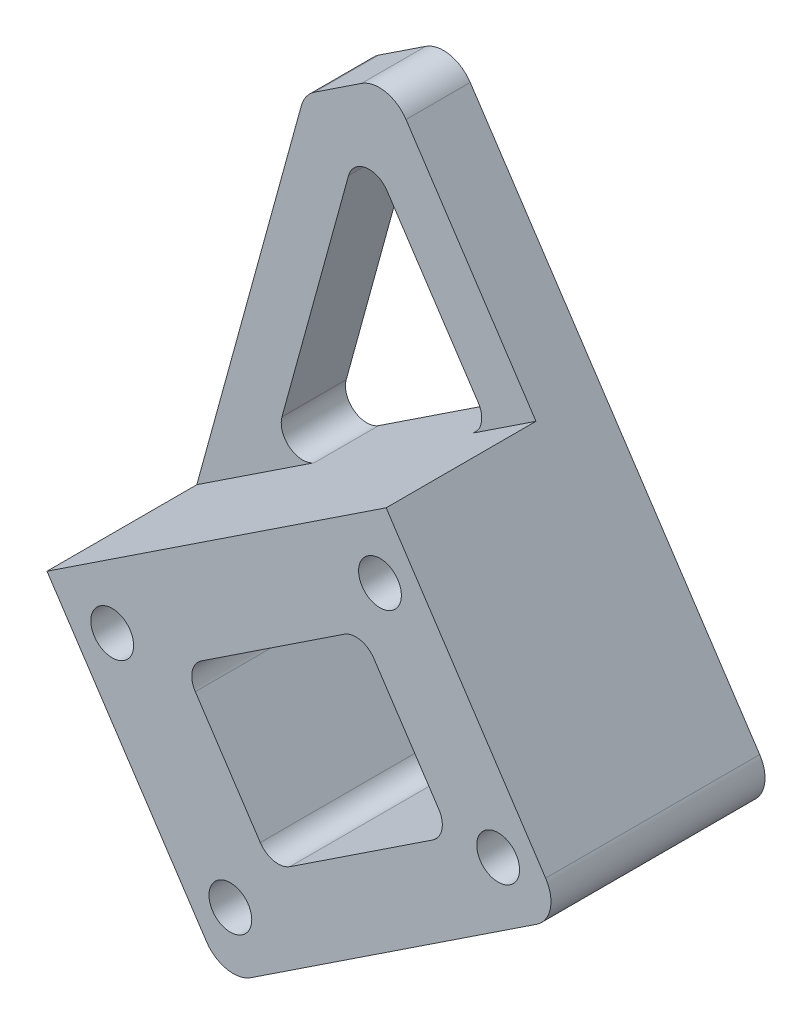
from build123d import *

# Parameters (mm, degrees)
EXTRUDE_1_DEPTH     = 20
CUT_EXTRUDE_1_DEPTH = 14


with BuildPart() as part:
    # 草图1 → 凸台-拉伸1 (new body)
    with BuildSketch(Plane.XY):
        with BuildLine():
            Line((-13.777542747, 27.154145307), (-23.544151188, -8.402088166))
            Line((-23.544151188, -8.402088166), (-8.641852584, -30.917005362))
            ThreePointArc((-8.641852584, -30.917005362), (-6.738298922, -32.20096852), (-4.484384162, -31.762851872))
            Line((-4.484384162, -31.762851872), (22.199962144, -14.100868342))
            ThreePointArc((22.199962144, -14.100868342), (23.483925302, -12.197314679), (23.045808654, -9.94339992))
            Line((23.045808654, -9.94339992), (-3.999103626, 30.917005362))
            ThreePointArc((-3.999103626, 30.917005362), (-5.902657289, 32.20096852), (-8.156572048, 31.762851872))
            Line((-8.156572048, 31.762851872), (-12.540501442, 28.861192305))
            ThreePointArc((-12.540501442, 28.861192305), (-13.313905715, 28.119907916), (-13.777542747, 27.154145307))
        make_face()
        with BuildLine():
            Line((-9.685923114, -11.221576533), (-3.614616276, -20.394320576))
            ThreePointArc((-3.614616276, -20.394320576), (-2.3455805, -21.250296015), (-0.842970661, -20.95821825))
            Line((-0.842970661, -20.95821825), (12.499202492, -12.127226485))
            ThreePointArc((12.499202492, -12.127226485), (13.355177931, -10.858190709), (13.063100166, -9.35558087))
            Line((13.063100166, -9.35558087), (6.991793327, -0.182836827))
            ThreePointArc((6.991793327, -0.182836827), (5.722757552, 0.673138612), (4.220147712, 0.381060846))
            Line((4.220147712, 0.381060846), (-9.122025441, -8.449930919))
            ThreePointArc((-9.122025441, -8.449930919), (-9.978000879, -9.718966694), (-9.685923114, -11.221576533))
        make_face(mode=Mode.SUBTRACT)
        with BuildLine():
            Line((-12.553966944, -1.1278439), (2.181398369, 8.62528164))
            ThreePointArc((2.181398369, 8.62528164), (3.037373808, 9.894317415), (2.745296043, 11.396927255))
            Line((2.745296043, 11.396927255), (-5.775124401, 24.269878325))
            ThreePointArc((-5.775124401, 24.269878325), (-7.758191259, 25.140995222), (-9.371464219, 23.695744666))
            Line((-9.371464219, 23.695744666), (-15.586409089, 1.069668056))
            ThreePointArc((-15.586409089, 1.069668056), (-14.831422966, -1.079549075), (-12.553966944, -1.1278439))
        make_face(mode=Mode.SUBTRACT)
        with BuildLine():
            ThreePointArc((20.274163039, -9.379502246), (17.502517425, -8.815604573), (16.938619751, -11.587250187))
            ThreePointArc((16.938619751, -11.587250187), (19.710265366, -12.151147861), (20.274163039, -9.379502246))
        make_face(mode=Mode.SUBTRACT)
        with BuildLine():
            ThreePointArc((-4.742411623, -25.937611806), (-7.514057237, -25.373714132), (-8.077954911, -28.145359747))
            ThreePointArc((-8.077954911, -28.145359747), (-5.306309296, -28.70925742), (-4.742411623, -25.937611806))
        make_face(mode=Mode.SUBTRACT)
        with BuildLine():
            ThreePointArc((-15.781151329, -9.259895364), (-18.552796944, -8.695997691), (-19.116694617, -11.467643305))
            ThreePointArc((-19.116694617, -11.467643305), (-16.345049002, -12.031540979), (-15.781151329, -9.259895364))
        make_face(mode=Mode.SUBTRACT)
        with BuildLine():
            ThreePointArc((9.235423333, 7.298214195), (6.463777718, 7.862111869), (5.899880045, 5.090466254))
            ThreePointArc((5.899880045, 5.090466254), (8.67152566, 4.52656858), (9.235423333, 7.298214195))
        make_face(mode=Mode.SUBTRACT)
    extrude(amount=EXTRUDE_1_DEPTH)

    # 草图2 → 切除-拉伸1 (cut)
    with BuildSketch(Plane.XY.offset(20)):
        Polygon((-23.544151188, -8.402088166), (8.143510051, 12.571517276), (-3.303511762, 40.217913112), (-41.454919937, 18.788693936), align=None)
    extrude(amount=-CUT_EXTRUDE_1_DEPTH, mode=Mode.SUBTRACT)


solid = part.part
